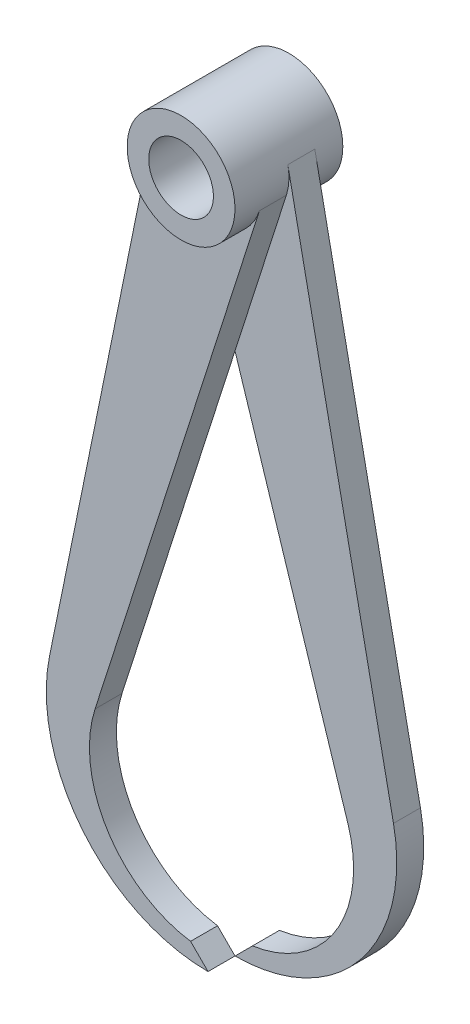
from build123d import *

# Parameters (mm, degrees)
SKETCH1_R           = 6.0000000000000036
BOSS_EXTRUDE1_DEPTH = 10
BOSS_EXTRUDE2_DEPTH = 5
BOSS_EXTRUDE9_DEPTH = 5


with BuildPart() as part:
    # Sketch1 → Boss-Extrude1 (new, symmetric)
    with BuildSketch(Plane.XY):
        with BuildLine():
            ThreePointArc((9.79795897113271, 107.00000000000001), (6.1e-16, 115.00000000000001), (-9.79795897113271, 107.00000000000001))
            ThreePointArc((-9.79795897113271, 107.00000000000001), (-9.985334211645554, 104.45861226303066), (-9.524285702381544, 101.95238095238096))
            ThreePointArc((-9.524285702381544, 101.95238095238096), (-1.84e-15, 95.00000000000001), (9.524285702381544, 101.95238095238096))
            ThreePointArc((9.524285702381544, 101.95238095238096), (9.880355687519943, 103.45773819080799), (9.999999999999998, 105.00000000000001))
            ThreePointArc((9.999999999999998, 105.00000000000001), (9.949361530051238, 106.00508962005209), (9.79795897113271, 107.00000000000001))
        make_face()
        with Locations((0, 105.00000000000001)):
            Circle(SKETCH1_R, mode=Mode.SUBTRACT)
    extrude(amount=BOSS_EXTRUDE1_DEPTH, both=True)

    # Sketch1<3> → Boss-Extrude2 (add)
    with BuildSketch(Plane.XY):
        with BuildLine():
            Line((-20.9534285452394, 6.704761904761905), (9.524285702381547, 101.95238095238096))
            ThreePointArc((9.524285702381546, 101.95238095238096), (-2.527516325759122, 95.32468805551879), (-9.797958971132713, 107.00000000000001))
            Line((-9.797958971132712, 107.00000000000001), (-29.393876913398135, 10.999999999999998))
            ThreePointArc((-29.393876913398135, 11.000000000000007), (-23.237900077244504, -13.97366596101027), (-5.51e-15, -25))
            Line((0, -24.999999999999996), (-3.2398704112739285, -21.76012958872607))
            ThreePointArc((-3.2398704112739405, -21.760129588726066), (-18.67863593878897, -11.623620755435104), (-20.953428545239426, 6.704761904761907))
        make_face()
    extrude(amount=BOSS_EXTRUDE2_DEPTH)


with BuildPart() as body_2:
    # Sketch1<8> → Boss-Extrude9 (new body)
    with BuildSketch(Plane.XY):
        with BuildLine():
            Line((3.2398704112739285, -21.76012958872607), (0, -24.999999999999996))
            ThreePointArc((0, -25), (23.237900077244504, -13.973665961010276), (29.393876913398135, 11))
            Line((29.393876913398135, 10.999999999999998), (9.797958971132712, 107.00000000000001))
            ThreePointArc((9.79795897113271, 107.00000000000001), (2.5275163257591244, 95.32468805551879), (-9.524285702381546, 101.95238095238096))
            Line((-9.524285702381547, 101.95238095238096), (20.953428545239394, 6.704761904761895))
            ThreePointArc((20.953428545239394, 6.704761904761899), (18.678635938788936, -11.6236207554351), (3.239870411273928, -21.760129588726066))
        make_face()
    extrude(amount=-BOSS_EXTRUDE9_DEPTH)


solid = Compound([part.part, body_2.part])
